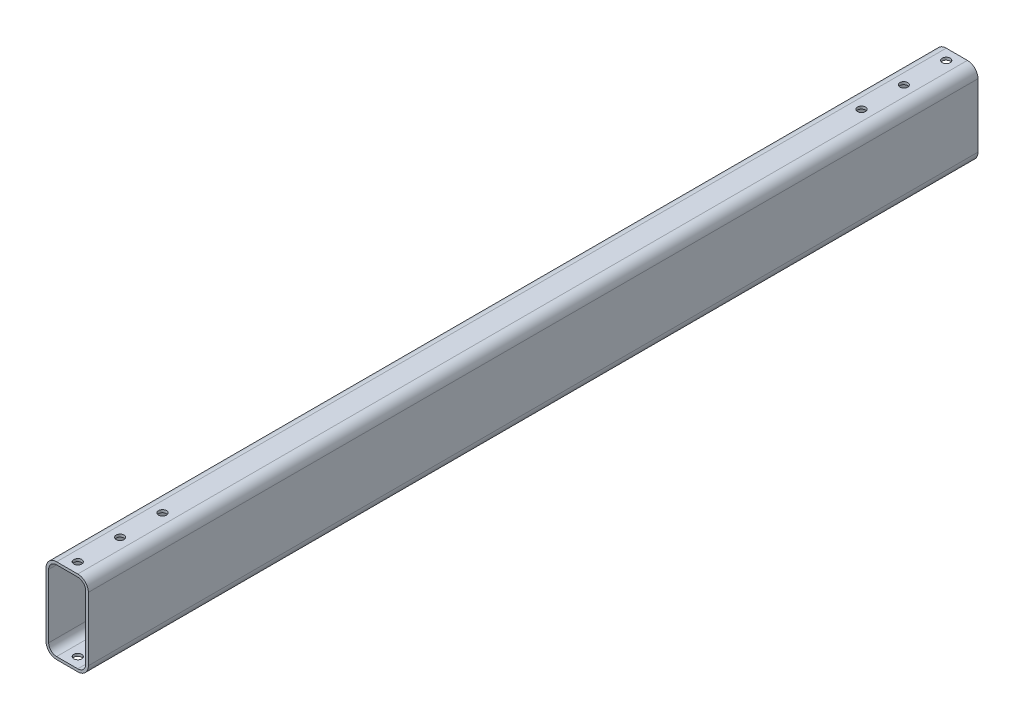
from build123d import *

# Parameters (mm, degrees)
EXTRUDE_THIN1_DEPTH               = 533.4
F_3_16_0_1875_DIAMETER_HOLE1_D    = 4.7625
F_3_16_0_195_DIAMETER_HOLE1_D     = 4.953
F_3_16_0_195_DIAMETER_HOLE1_DEPTH = 1.5875


with BuildPart() as part:
    # Sketch1 → Extrude-Thin1 (new body)
    with BuildSketch(Plane.XY):
        with BuildLine():
            Line((-12.7, 19.05), (-12.7, -19.05))
            ThreePointArc((-12.7, -19.05), (-10.840128061, -23.540128061), (-6.35, -25.4))
            Line((-6.35, -25.4), (6.35, -25.4))
            ThreePointArc((6.35, -25.4), (10.840128061, -23.540128061), (12.7, -19.05))
            Line((12.7, -19.05), (12.7, 19.05))
            ThreePointArc((12.7, 19.05), (10.840128061, 23.540128061), (6.35, 25.4))
            Line((6.35, 25.4), (-6.35, 25.4))
            ThreePointArc((-6.35, 25.4), (-10.840128061, 23.540128061), (-12.7, 19.05))
        make_face()
        with BuildLine():
            Line((-11.1125, 19.05), (-11.1125, -19.05))
            ThreePointArc((-11.1125, -19.05), (-9.717596045, -22.417596045), (-6.35, -23.8125))
            Line((-6.35, -23.8125), (6.35, -23.8125))
            ThreePointArc((6.35, -23.8125), (9.717596045, -22.417596045), (11.1125, -19.05))
            Line((11.1125, -19.05), (11.1125, 19.05))
            ThreePointArc((11.1125, 19.05), (9.717596045, 22.417596045), (6.35, 23.8125))
            Line((6.35, 23.8125), (-6.35, 23.8125))
            ThreePointArc((-6.35, 23.8125), (-9.717596045, 22.417596045), (-11.1125, 19.05))
        make_face(mode=Mode.SUBTRACT)
    extrude(amount=EXTRUDE_THIN1_DEPTH)

    # 3/16 (0.1875) Diameter Hole1 (through all)
    with Locations(Plane(origin=(0, 25.4, 527.05), x_dir=(0, 0, 1), z_dir=(0, 1, 0))):
        with Locations((0, 0), (-520.7, 0), (-495.3, 0), (-469.9, 0), (-25.4, 0), (-50.8, 0)):
            Hole(F_3_16_0_1875_DIAMETER_HOLE1_D / 2)

    # 3/16 (0.195) Diameter Hole1
    with Locations(Plane(origin=(0, -25.4, 0), x_dir=(-1, 0, 0), z_dir=(0, -1, 0))):
        with Locations((-6.331002809, -114.316339601), (0.281657017, -139.649227909), (-5.805002341, -165.113616334), (0.807657485, -190.446504642), (-3.175, -419.1), (2.911659358, -393.635611575), (-3.701000468, -368.302723267), (2.385658889, -342.838334842)):
            Hole(F_3_16_0_195_DIAMETER_HOLE1_D / 2, depth=F_3_16_0_195_DIAMETER_HOLE1_DEPTH)


solid = part.part
